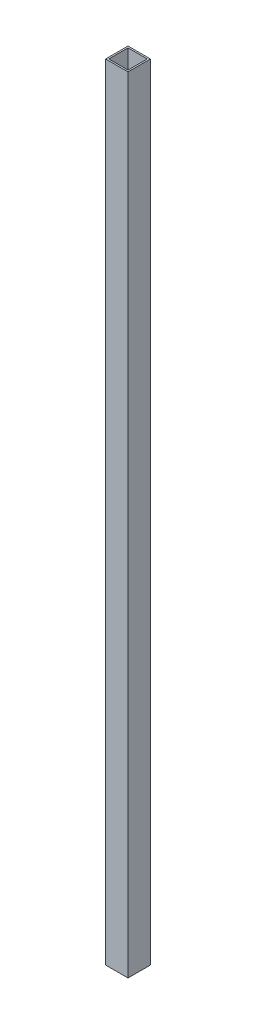
from build123d import *

# Parameters (mm, degrees)
SKETCH1_W           = 17
SKETCH1_H           = 17
SKETCH1_W_2         = 14.6
SKETCH1_H_2         = 14.6
BOSS_EXTRUDE1_DEPTH = 595


with BuildPart() as part:
    # Sketch1 → Boss-Extrude1 (new body)
    with BuildSketch(Plane(origin=(0, 0, 0), x_dir=(1, 0, 0), z_dir=(0, 1, 0))):
        Rectangle(SKETCH1_W, SKETCH1_H)
        Rectangle(SKETCH1_W_2, SKETCH1_H_2, mode=Mode.SUBTRACT)
    extrude(amount=BOSS_EXTRUDE1_DEPTH)


solid = part.part
